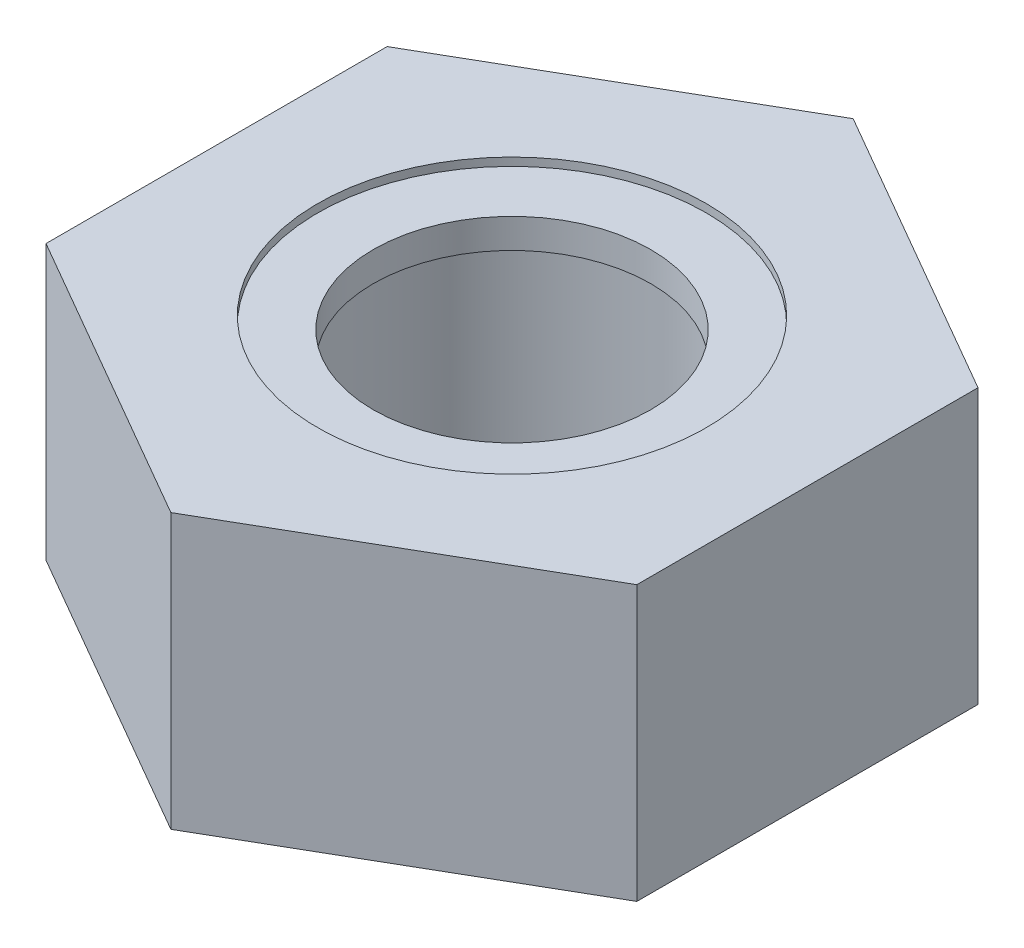
from build123d import *

# Parameters (mm, degrees)
EXTRUDE1_DEPTH = 5.159375
SKETCH2_W      = 3.175
SKETCH2_H      = 5.159375


with BuildPart() as part:
    # Sketch1 → Extrude1 (new body)
    with BuildSketch(Plane(origin=(0, 0, 0), x_dir=(1, 0, 0), z_dir=(0, 1, 0))):
        Polygon((0, 6.415804866), (-5.55625, 3.207902433), (-5.55625, -3.207902433), (0, -6.415804866), (5.55625, -3.207902433), (5.55625, 3.207902433), align=None)
    extrude(amount=EXTRUDE1_DEPTH)

    # Sketch4 → Cut-Revolve2 (revolve, cut)
    with BuildSketch(Plane(origin=(0, 0, 0), x_dir=(0, 0, -1), z_dir=(1, 0, 0))):
        Polygon((0, 5.159375), (3.175, 5.159375), (2.609908356, 4.895868439), (2.609908356, 0.263506561), (3.175, 0), (0, 0), align=None)
    revolve(axis=Axis((0, 5.159375, 0), (0, 1, 0)), mode=Mode.SUBTRACT)


with BuildPart() as body_2:
    # Sketch2 → Revolve1 (revolve)
    with BuildSketch(Plane(origin=(0, 0, 0), x_dir=(0, 0, -1), z_dir=(1, 0, 0))):
        with Locations((1.5875, 2.5796875)):
            Rectangle(SKETCH2_W, SKETCH2_H)
    revolve(axis=Axis((0, -3.175, 0), (0, 1, 0)))


with BuildPart() as part_1:
    add(part.part)

    # Combine1: cut body 2
    add(body_2.part, mode=Mode.SUBTRACT)

    # Sketch6 → Cut-Revolve4 (revolve, cut)
    with BuildSketch(Plane(origin=(0, 0, 0), x_dir=(0, 0, -1), z_dir=(1, 0, 0))):
        with BuildLine():
            Line((0, 4.299479167), (5.40385, 4.299479167))
            ThreePointArc((5.40385, 4.299479167), (5.196629268, 4.799754268), (4.696354167, 5.006975))
            Line((4.696354167, 5.006975), (3.653131261, 5.006975))
            Line((3.653131261, 5.006975), (3.653131261, 6.429375))
            Line((3.653131261, 6.429375), (0, 6.429375))
            Line((0, 6.429375), (0, 4.299479167))
        make_face()
    revolve(axis=Axis((0, 6.429375, 0), (0, 1, 0)), mode=Mode.SUBTRACT)


with BuildPart() as body_2_2:
    # Sketch7 → Revolve2 (revolve)
    with BuildSketch(Plane(origin=(0, 0, 0), x_dir=(0, 0, -1), z_dir=(1, 0, 0))):
        with BuildLine():
            Line((2.609908356, 4.375679167), (5.3230343, 4.375679167))
            ThreePointArc((5.3230343, 4.375679167), (5.114940888, 4.772046184), (4.696354167, 4.930775))
            Line((4.696354167, 4.930775), (2.609908356, 4.930775))
            Line((2.609908356, 4.930775), (2.609908356, 4.375679167))
        make_face()
    revolve(axis=Axis((0, 4.375679167, 0), (0, 1, 0)))


solid = Compound([part_1.part, body_2_2.part])
